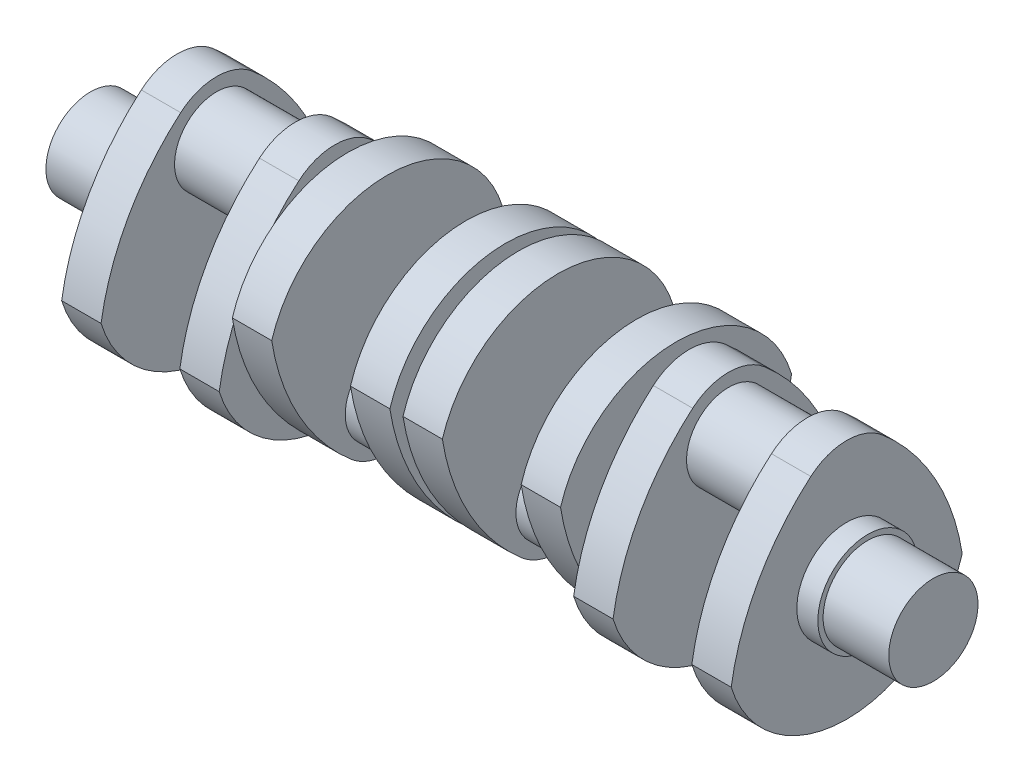
from build123d import *

# Parameters (mm, degrees)
SKETCH1_R            = 17
BOSS_EXTRUDE3_DEPTH  = 25
SKETCH3_R            = 19
BOSS_EXTRUDE4_DEPTH  = 8
BOSS_EXTRUDE5_DEPTH  = 15
SKETCH5_R            = 16
BOSS_EXTRUDE6_DEPTH  = 15
BOSS_EXTRUDE7_START  = 5
SKETCH6_R            = 17
BOSS_EXTRUDE7_DEPTH  = 5
BOSS_EXTRUDE8_DEPTH  = 15
SKETCH8_R            = 16
BOSS_EXTRUDE9_DEPTH  = 30
BOSS_EXTRUDE10_DEPTH = 15
BOSS_EXTRUDE11_START = 2.5
SKETCH10_R           = 17
BOSS_EXTRUDE11_DEPTH = 2.5


with BuildPart() as part:
    # Sketch1 → Boss-Extrude3 (new body)
    with BuildSketch(Plane(origin=(0, 0, 0), x_dir=(0, 0, -1), z_dir=(1, 0, 0))):
        Circle(SKETCH1_R)
    extrude(amount=-BOSS_EXTRUDE3_DEPTH)

    # Sketch3 → Boss-Extrude4 (add)
    with BuildSketch(Plane(origin=(0, 0, 0), x_dir=(0, 0, -1), z_dir=(1, 0, 0))):
        Circle(SKETCH3_R)
    extrude(amount=BOSS_EXTRUDE4_DEPTH)

    # Sketch4 → Boss-Extrude5 (add)
    with BuildSketch(Plane(origin=(8, 0, 0), x_dir=(0, 0, -1), z_dir=(1, 0, 0))):
        with BuildLine():
            ThreePointArc((-13.668094758, 40.943123461), (0, 46), (13.668094758, 40.943123461))
            ThreePointArc((13.668094758, 40.943123461), (33.683444249, 16.469257624), (44, -13.416407865))
            ThreePointArc((44, -13.416407865), (0, -46), (-44, -13.416407865))
            ThreePointArc((-44, -13.416407865), (-33.683444249, 16.469257624), (-13.668094758, 40.943123461))
        make_face()
    boss_extrude5 = extrude(amount=BOSS_EXTRUDE5_DEPTH)

    # Sketch5 → Boss-Extrude6 (add)
    with BuildSketch(Plane(origin=(23, 0, 0), x_dir=(0, 0, -1), z_dir=(1, 0, 0))):
        with Locations((0, 25)):
            Circle(SKETCH5_R)
    boss_extrude6 = extrude(amount=BOSS_EXTRUDE6_DEPTH)

    # Mirror1: Boss-Extrude5, Boss-Extrude6 across plane
    add(boss_extrude5.mirror(Plane(origin=(38, 25, 0), x_dir=(0, 0, 1), z_dir=(1, 0, 0))))
    add(boss_extrude6.mirror(Plane(origin=(38, 25, 0), x_dir=(0, 0, 1), z_dir=(1, 0, 0))))

    # Sketch6 → Boss-Extrude7 (add)
    with BuildSketch(Plane(origin=(68, 0, 0), x_dir=(0, 0, -1), z_dir=(1, 0, 0)).offset(BOSS_EXTRUDE7_START)):
        Circle(SKETCH6_R)
    extrude(amount=-BOSS_EXTRUDE7_DEPTH)

    # Sketch7 → Boss-Extrude8 (add)
    with BuildSketch(Plane(origin=(73, 0, 0), x_dir=(0, 0, -1), z_dir=(1, 0, 0))):
        with BuildLine():
            ThreePointArc((-13.668094758, -40.943123461), (0, -46), (13.668094758, -40.943123461))
            ThreePointArc((13.668094758, -40.943123461), (33.683444249, -16.469257624), (44, 13.416407865))
            ThreePointArc((44, 13.416407865), (0, 46), (-44, 13.416407865))
            ThreePointArc((-44, 13.416407865), (-33.683444249, -16.469257624), (-13.668094758, -40.943123461))
        make_face()
    extrude(amount=BOSS_EXTRUDE8_DEPTH)

    # Sketch8 → Boss-Extrude9 (add)
    with BuildSketch(Plane(origin=(88, 0, 0), x_dir=(0, 0, -1), z_dir=(1, 0, 0))):
        with Locations((0, -25)):
            Circle(SKETCH8_R)
    extrude(amount=BOSS_EXTRUDE9_DEPTH)

    # Sketch9 → Boss-Extrude10 (add)
    with BuildSketch(Plane(origin=(118, 0, 0), x_dir=(0, 0, -1), z_dir=(1, 0, 0))):
        with BuildLine():
            ThreePointArc((-13.668094758, -40.943123461), (0, -46), (13.668094758, -40.943123461))
            ThreePointArc((13.668094758, -40.943123461), (33.683444249, -16.469257624), (44, 13.416407865))
            ThreePointArc((44, 13.416407865), (0, 46), (-44, 13.416407865))
            ThreePointArc((-44, 13.416407865), (-33.683444249, -16.469257624), (-13.668094758, -40.943123461))
        make_face()
    extrude(amount=BOSS_EXTRUDE10_DEPTH)

    # Sketch10 → Boss-Extrude11 (add)
    with BuildSketch(Plane(origin=(133, 0, 0), x_dir=(0, 0, -1), z_dir=(1, 0, 0)).offset(BOSS_EXTRUDE11_START)):
        Circle(SKETCH10_R)
    extrude(amount=-BOSS_EXTRUDE11_DEPTH)

    # Mirror2: part across plane


with BuildPart() as part_1:
    add(part.part)
    add(part.part.mirror(Plane(origin=(135.5, 0, 0), x_dir=(0, 0, 1), z_dir=(1, 0, 0))))


solid = part_1.part
